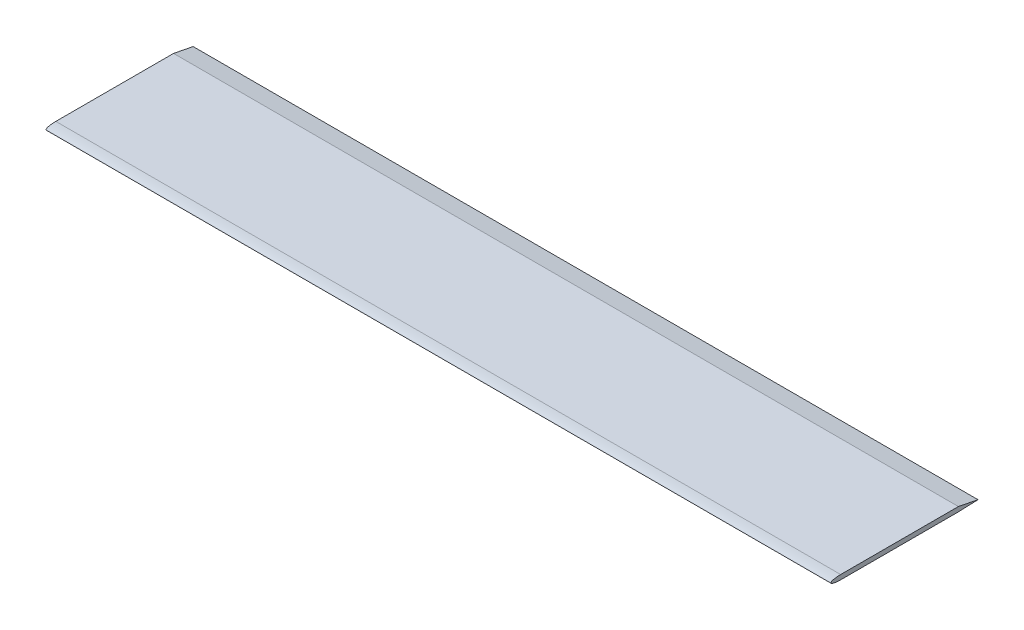
from build123d import *

# Parameters (mm, degrees)
BOSS_EXTRUDE1_DEPTH = 1016


with BuildPart() as part:
    # Sketch1 → Boss-Extrude1 (new body)
    with BuildSketch(Plane(origin=(0, 0, 0), x_dir=(0, 0, -1), z_dir=(1, 0, 0))):
        with BuildLine():
            Line((150.728463896, -2.999999969), (150.728463896, 2.999999969))
            Line((150.728463896, 2.999999969), (-1.671536104, 2.999999969))
            add(Edge.make_bspline(
                [(-1.671536104, -2.999999969), (11.028463896, -2.999999969), (11.028463896, 0), (11.028463896, 2.999999969), (-1.671536104, 2.999999969)],
                knots=[1.570796327, 1.570796327, 1.570796327, 3.141592654, 3.141592654, 4.71238898, 4.71238898, 4.71238898], degree=2, weights=[1, 0.707106781, 1, 0.707106781, 1]))
            Line((-1.671536104, -2.999999969), (150.728463896, -2.999999969))
        make_face()
        with BuildLine():
            add(Edge.make_bspline(
                [(-1.671536104, -2.999999969), (11.028463896, -2.999999969), (11.028463896, 0), (11.028463896, 2.999999969), (-1.671536104, 2.999999969)],
                knots=[1.570796327, 1.570796327, 1.570796327, 3.141592654, 3.141592654, 4.71238898, 4.71238898, 4.71238898], degree=2, weights=[1, 0.707106781, 1, 0.707106781, 1]))
            Line((-1.671536104, 2.999999969), (-1.671536104, -2.999999969))
        make_face()
        with BuildLine():
            Line((-1.671536104, -2.999999969), (-1.671536104, 2.999999969))
            add(Edge.make_bspline(
                [(-1.671536104, 2.999999969), (-14.371536104, 2.999999969), (-14.371536104, 0)],
                knots=[4.71238898, 4.71238898, 4.71238898, 6.283185307, 6.283185307, 6.283185307], degree=2, weights=[1, 0.707106781, 1]))
            add(Edge.make_bspline(
                [(-14.371536104, 0), (-14.371536104, -2.999999969), (-1.671536104, -2.999999969)],
                knots=[0, 0, 0, 1.570796327, 1.570796327, 1.570796327], degree=2, weights=[1, 0.707106781, 1]))
        make_face()
        Polygon((150.728463896, 2.999999969), (176.128463896, -1.999999937), (150.728463896, -2.999999969), align=None)
    extrude(amount=BOSS_EXTRUDE1_DEPTH)


solid = part.part
